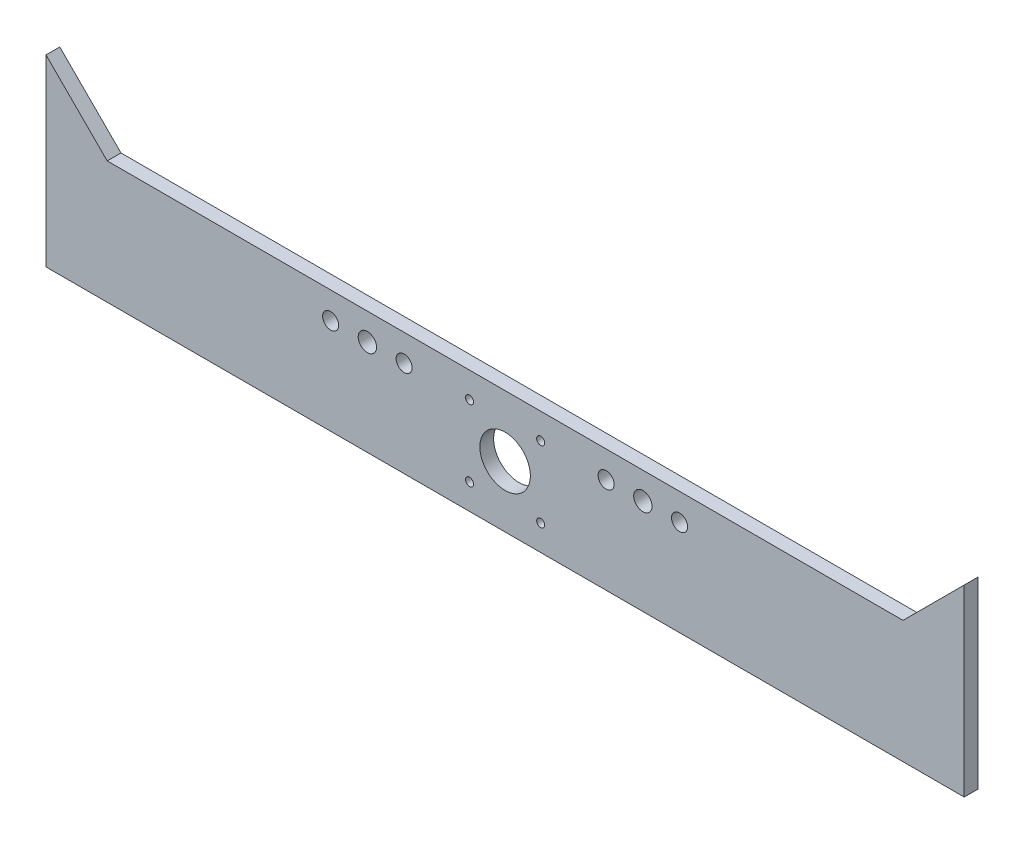
from build123d import *

# Parameters (mm, degrees)
BOSS_EXTRUDE1_DEPTH = 6
SKETCH2_R           = 11
SKETCH2_R_2         = 1.75
SKETCH2_R_3         = 4
SKETCH2_R_4         = 3.5
CUT_EXTRUDE1_DEPTH  = 216.490138986


with BuildPart() as part:
    # Sketch1 → Boss-Extrude1 (new body)
    with BuildSketch(Plane.XY):
        Polygon((-200, 0), (200, 0), (200, 80), (173.333333333, 53.333333333), (-173.333333333, 53.333333333), (-200, 80), align=None)
    extrude(amount=BOSS_EXTRUDE1_DEPTH)

    # Sketch2 → Cut-Extrude1 (cut, through all)
    with BuildSketch(Plane.XY.offset(6)):
        with Locations((0, 26.665)):
            Circle(SKETCH2_R)
        with Locations((15.5, 42.165)):
            Circle(SKETCH2_R_2)
        with Locations(Location((-15.5, 42.165, 0), (0, 0, 180))):
            Circle(SKETCH2_R_2)
        with Locations((-15.5, 11.165)):
            Circle(SKETCH2_R_2)
        with Locations(Location((15.5, 11.165, 0), (0, 0, 180))):
            Circle(SKETCH2_R_2)
        with Locations((60, 41.665)):
            Circle(SKETCH2_R_3)
        with Locations((76, 41.665)):
            Circle(SKETCH2_R_4)
        with Locations((44, 41.665)):
            Circle(SKETCH2_R_4)
        with Locations(Location((-44, 41.665, 0), (0, 0, 180))):
            Circle(SKETCH2_R_4)
        with Locations(Location((-76, 41.665, 0), (0, 0, 180))):
            Circle(SKETCH2_R_4)
        with Locations(Location((-60, 41.665, 0), (0, 0, 180))):
            Circle(SKETCH2_R_3)
    extrude(amount=-CUT_EXTRUDE1_DEPTH, mode=Mode.SUBTRACT)


solid = part.part
